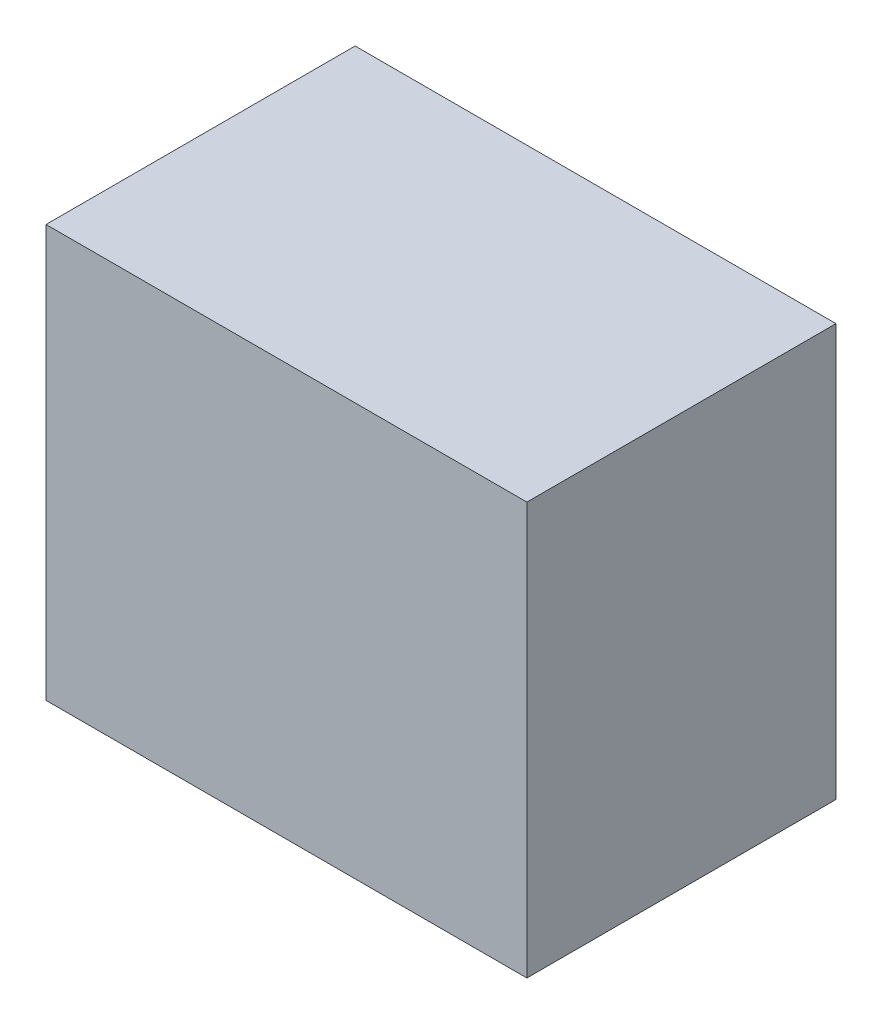
from build123d import *

# Parameters (mm, degrees)
SKETCH1_W           = 44.45
SKETCH1_H           = 28.575
BOSS_EXTRUDE1_DEPTH = 38.1


with BuildPart() as part:
    # Sketch1 → Boss-Extrude1 (new body)
    with BuildSketch(Plane(origin=(0, 0, 0), x_dir=(1, 0, 0), z_dir=(0, 1, 0))):
        Rectangle(SKETCH1_W, SKETCH1_H)
    extrude(amount=BOSS_EXTRUDE1_DEPTH)


solid = part.part
